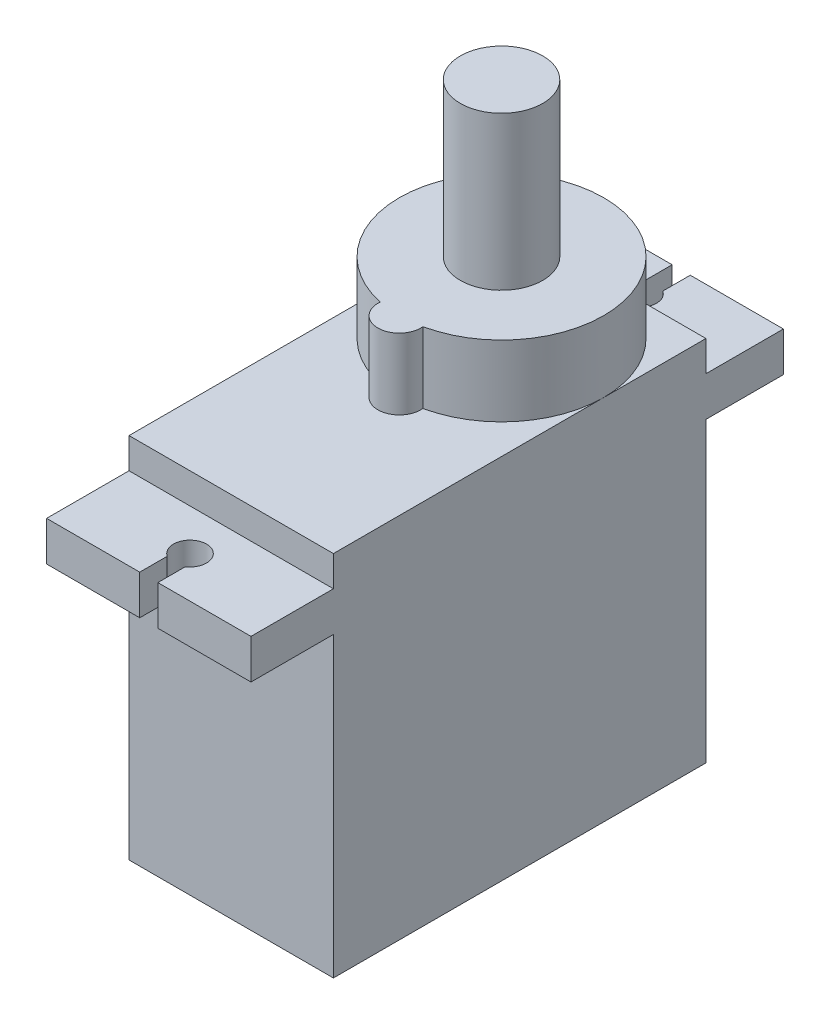
from build123d import *

# Parameters (mm, degrees)
SKETCH_1_W      = 12.4
SKETCH_1_H      = 22.3
EXTRUDE_1_DEPTH = 22.6
EXTRUDE_2_DEPTH = 4.3
SKETCH_3_R      = 2.5
EXTRUDE_3_DEPTH = 9.3
EXTRUDE_4_DEPTH = 2.4
SKETCH_5_R      = 0.6
EXTRUDE_5_DEPTH = 2.3


with BuildPart() as part:
    # 草图1 → 凸台-拉伸1 (new body)
    with BuildSketch(Plane.XY):
        Rectangle(SKETCH_1_W, SKETCH_1_H)
    extrude(amount=EXTRUDE_1_DEPTH)

    # 草图2 → 凸台-拉伸2 (add)
    with BuildSketch(Plane(origin=(0, 11.15, 0), x_dir=(1, 0, 0), z_dir=(0, 1, 0))):
        with BuildLine():
            ThreePointArc((1.29283601, -12.263709677), (0, 0), (-1.29283601, -12.263709677))
            ThreePointArc((-1.29283601, -12.263709677), (0, -13.7), (1.29283601, -12.263709677))
        make_face()
    extrude(amount=EXTRUDE_2_DEPTH)

    # 草图3 → 凸台-拉伸3 (add)
    with BuildSketch(Plane(origin=(0, 15.45, 0), x_dir=(1, 0, 0), z_dir=(0, 1, 0))):
        with Locations(Location((0, -6.2, 0), (0, 0, 270))):
            Circle(SKETCH_3_R)
    extrude(amount=EXTRUDE_3_DEPTH)

    # 草图4 → 凸台-拉伸4 (add)
    with BuildSketch(Plane(origin=(0, 9.3, 0), x_dir=(1, 0, 0), z_dir=(0, 1, 0))):
        with BuildLine():
            Line((6.2, -22.6), (-6.2, -22.6))
            Line((-6.2, -22.6), (-6.2, -27.6))
            Line((-6.2, -27.6), (-0.55, -27.6))
            Line((-0.55, -27.6), (-0.55, -25.935164654))
            ThreePointArc((-0.55, -25.935164654), (0, -24.1), (0.55, -25.935164654))
            Line((0.55, -25.935164654), (0.55, -27.6))
            Line((0.55, -27.6), (6.2, -27.6))
            Line((6.2, -27.6), (6.2, -22.6))
        make_face()
        with BuildLine():
            Line((0.55, 3.035164654), (0.55, 4.7))
            Line((0.55, 4.7), (6.2, 4.7))
            Line((6.2, 4.7), (6.2, -0.3))
            Line((6.2, -0.3), (-6.2, -0.3))
            Line((-6.2, -0.3), (-6.2, 4.7))
            Line((-6.2, 4.7), (-0.55, 4.7))
            Line((-0.55, 4.7), (-0.55, 3.035164654))
            ThreePointArc((-0.55, 3.035164654), (0, 1.2), (0.55, 3.035164654))
        make_face()
    extrude(amount=-EXTRUDE_4_DEPTH)

    # 草图5 → 凸台-拉伸5 (add)
    with BuildSketch(Plane(origin=(0, 0, 0), x_dir=(-1, 0, 0), z_dir=(0, 0, -1))):
        with Locations((0, -6.65)):
            Circle(SKETCH_5_R)
        with Locations((-1.21, -6.65)):
            Circle(SKETCH_5_R)
        with Locations((1.21, -6.65)):
            Circle(SKETCH_5_R)
    extrude(amount=EXTRUDE_5_DEPTH)


solid = part.part
